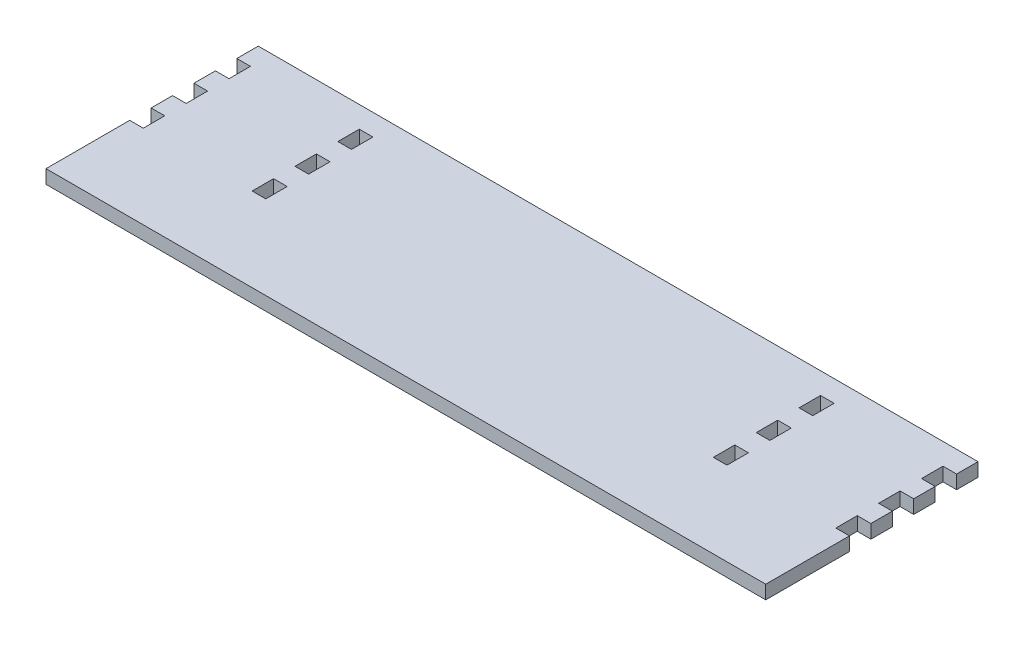
from build123d import *

# Parameters (mm, degrees)
SKETCH1_W           = 3.175
SKETCH1_H           = 5
BOSS_EXTRUDE1_DEPTH = 3.175


with BuildPart() as part:
    # Sketch1 → Boss-Extrude1 (new body)
    with BuildSketch(Plane(origin=(0, 0, 0), x_dir=(1, 0, 0), z_dir=(0, 1, 0))):
        Polygon((-167.9575, -5), (-164.7825, -5), (-164.7825, -10), (-167.9575, -10), (-167.9575, -15), (-164.7825, -15), (-164.7825, -20), (-167.9575, -20), (-167.9575, -25), (-164.7825, -25), (-164.7825, -30), (-167.9575, -30), (-167.9575, -49.53), (-164.7825, -49.53), (-66.4845, -49.53), (0, -49.53), (0, -30), (-3.175, -30), (-3.175, -25), (0, -25), (0, -20), (-3.175, -20), (-3.175, -15), (0, -15), (0, -10), (-3.175, -10), (-3.175, -5), (0, -5), (0, 0), (-66.4845, 0), (-164.7825, 0), (-167.9575, 0), align=None)
        with Locations((-137.795, -7.5)):
            Rectangle(SKETCH1_W, SKETCH1_H, mode=Mode.SUBTRACT)
        with Locations((-137.795, -17.5)):
            Rectangle(SKETCH1_W, SKETCH1_H, mode=Mode.SUBTRACT)
        with Locations((-137.795, -27.5)):
            Rectangle(SKETCH1_W, SKETCH1_H, mode=Mode.SUBTRACT)
        with Locations((-30.1625, -27.5)):
            Rectangle(SKETCH1_W, SKETCH1_H, mode=Mode.SUBTRACT)
        with Locations((-30.1625, -17.5)):
            Rectangle(SKETCH1_W, SKETCH1_H, mode=Mode.SUBTRACT)
        with Locations((-30.1625, -7.5)):
            Rectangle(SKETCH1_W, SKETCH1_H, mode=Mode.SUBTRACT)
    extrude(amount=BOSS_EXTRUDE1_DEPTH)


solid = part.part
